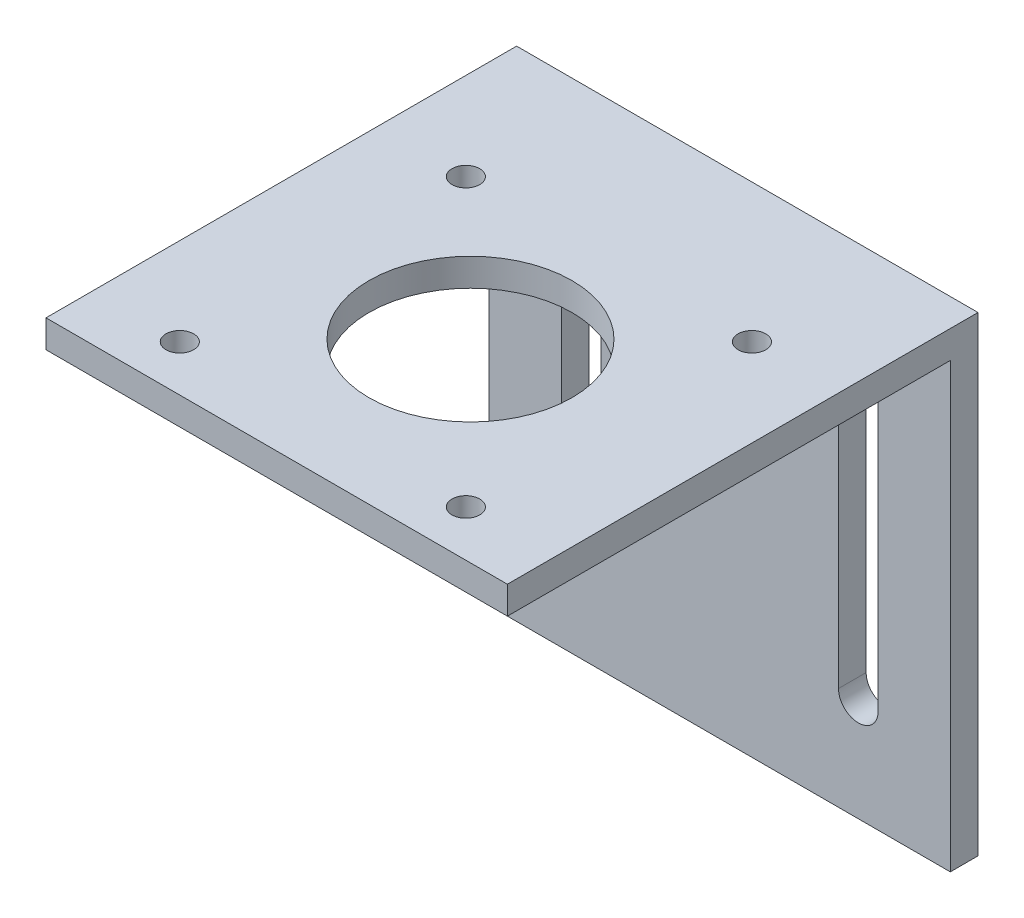
from build123d import *

# Parameters (mm, degrees)
SKETCH1_W               = 50
SKETCH1_H               = 51
BOSS_EXTRUDE1_DEPTH     = 3
SKETCH2_W               = 50
SKETCH2_H               = 3
BOSS_EXTRUDE2_DEPTH     = 48
CUT_EXTRUDE1_DEPTH      = 75.36396977
CUT_EXTRUDE1_DEPTH_BACK = 75.36396977
SKETCH3_R               = 11
SKETCH3_R_2             = 1.5


with BuildPart() as part:
    # Sketch1 → Boss-Extrude1 (new body)
    with BuildSketch(Plane.XY):
        Rectangle(SKETCH1_W, SKETCH1_H)
        with BuildLine():
            Line((-17.15, 15.35), (-17.15, -14.35))
            ThreePointArc((-17.15, -14.35), (-15, -16.5), (-12.85, -14.35))
            Line((-12.85, -14.35), (-12.85, 15.35))
            ThreePointArc((-12.85, 15.35), (-15, 17.5), (-17.15, 15.35))
        make_face(mode=Mode.SUBTRACT)
        with BuildLine():
            Line((12.88, 15.35), (12.88, -14.35))
            ThreePointArc((12.88, -14.35), (15.03, -16.5), (17.18, -14.35))
            Line((17.18, -14.35), (17.18, 15.35))
            ThreePointArc((17.18, 15.35), (15.03, 17.5), (12.88, 15.35))
        make_face(mode=Mode.SUBTRACT)
    extrude(amount=BOSS_EXTRUDE1_DEPTH)

    # Sketch2 → Boss-Extrude2 (add)
    with BuildSketch(Plane.XY.offset(3)):
        with Locations((0, 24)):
            Rectangle(SKETCH2_W, SKETCH2_H)
    extrude(amount=BOSS_EXTRUDE2_DEPTH)

    # Sketch3 → Cut-Extrude1 (cut, two sides: drawn at the far end of the back side and taken through both)
    with BuildSketch(Plane.XZ.offset(-22.5).offset(-CUT_EXTRUDE1_DEPTH_BACK)):
        with Locations((0, 30)):
            Circle(SKETCH3_R)
        with Locations((-15.5, 46)):
            Circle(SKETCH3_R_2)
        with Locations((15.5, 46)):
            Circle(SKETCH3_R_2)
        with Locations((-15.5, 15)):
            Circle(SKETCH3_R_2)
        with Locations((15.5, 15)):
            Circle(SKETCH3_R_2)
    extrude(amount=CUT_EXTRUDE1_DEPTH + CUT_EXTRUDE1_DEPTH_BACK, mode=Mode.SUBTRACT)


solid = part.part
